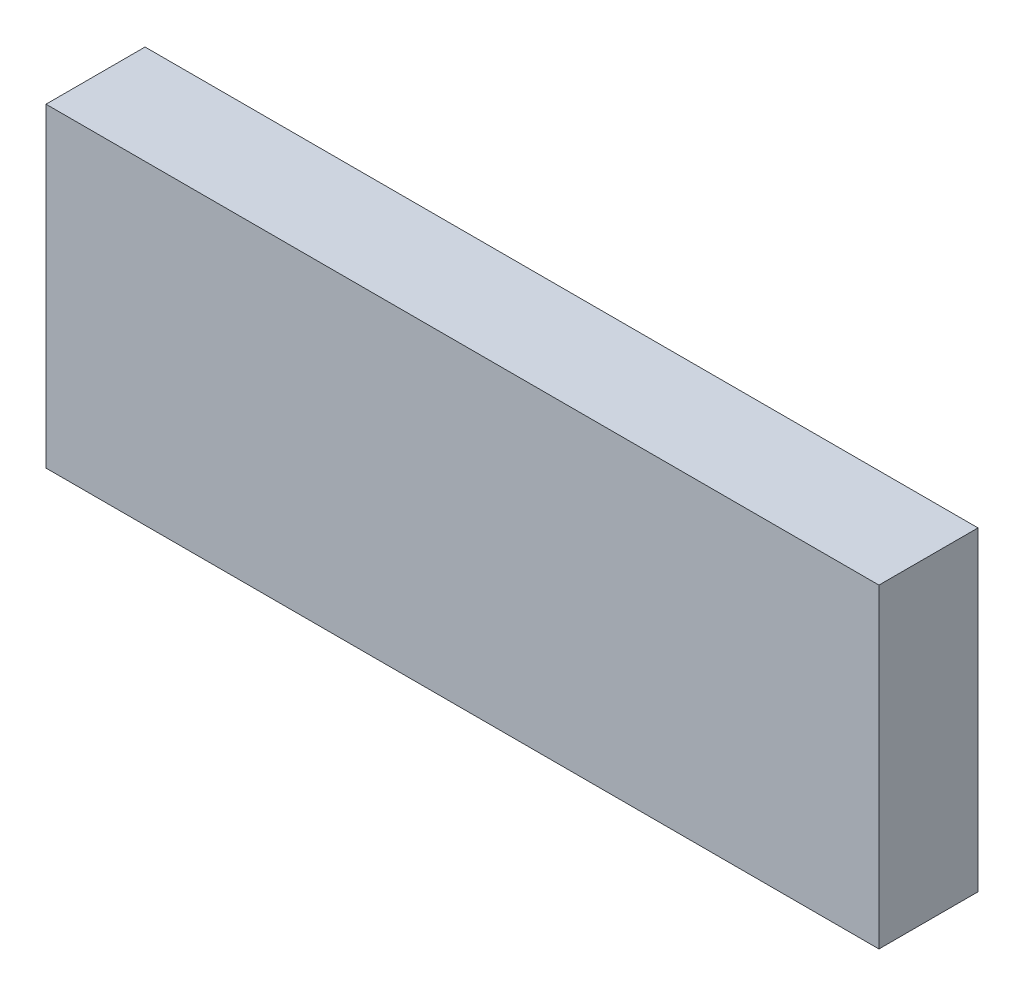
from build123d import *

# Parameters (mm, degrees)
ESQUISSE1_W        = 185
ESQUISSE1_H        = 22
BOSS_EXTRU_1_DEPTH = 70


with BuildPart() as part:
    # Esquisse1 → Boss.-Extru.1 (new body)
    with BuildSketch(Plane(origin=(0, 0, 0), x_dir=(1, 0, 0), z_dir=(0, 1, 0))):
        Rectangle(ESQUISSE1_W, ESQUISSE1_H)
    extrude(amount=BOSS_EXTRU_1_DEPTH)


solid = part.part
